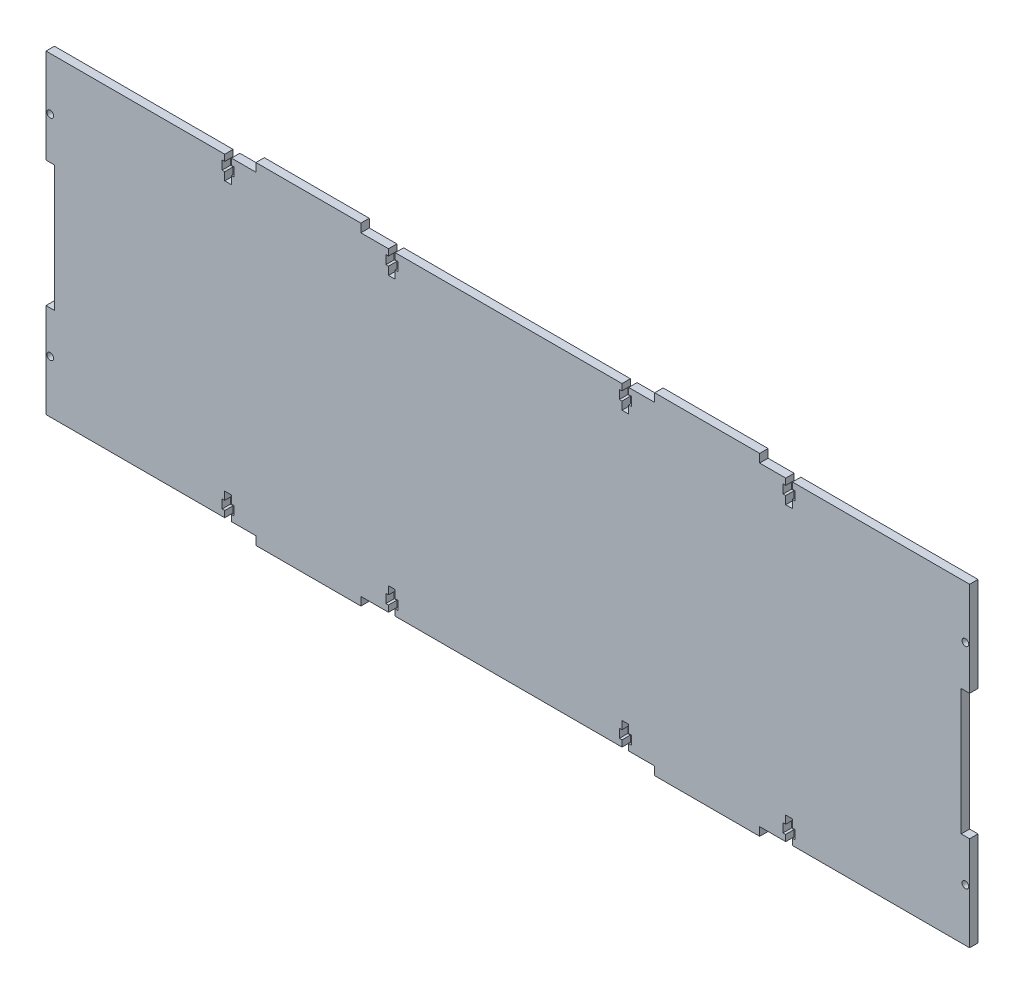
from build123d import *

# Parameters (mm, degrees)
ESQUISSE1_W             = 440
ESQUISSE1_H             = 150
BOSS_EXTRU_1_DEPTH      = 4
ESQUISSE2_W             = 4
ESQUISSE2_H             = 60
ENL_V_MAT_EXTRU_1_DEPTH = 4
ESQUISSE3_W             = 50
ESQUISSE3_H             = 4
BOSS_EXTRU_2_DEPTH      = 4
ENL_V_MAT_EXTRU_2_DEPTH = 10
ESQUISSE5_R             = 1.6
ENL_V_MAT_EXTRU_3_DEPTH = 4


with BuildPart() as part:
    # Esquisse1 → Boss.-Extru.1 (new body)
    with BuildSketch(Plane.XY):
        Rectangle(ESQUISSE1_W, ESQUISSE1_H)
    extrude(amount=BOSS_EXTRU_1_DEPTH)

    # Esquisse2 → Enlèv. mat.-Extru.1 (cut)
    with BuildSketch(Plane.XY.offset(4)):
        with Locations((-218, 0)):
            Rectangle(ESQUISSE2_W, ESQUISSE2_H)
        with Locations((218, 0)):
            Rectangle(ESQUISSE2_W, ESQUISSE2_H)
    extrude(amount=-ENL_V_MAT_EXTRU_1_DEPTH, mode=Mode.SUBTRACT)

    # Esquisse3 → Boss.-Extru.2 (add)
    with BuildSketch(Plane.XY.offset(4)):
        with Locations((-95, -77)):
            Rectangle(ESQUISSE3_W, ESQUISSE3_H)
        with Locations((95, -77)):
            Rectangle(ESQUISSE3_W, ESQUISSE3_H)
        with Locations((95, 77)):
            Rectangle(ESQUISSE3_W, ESQUISSE3_H)
        with Locations((-95, 77)):
            Rectangle(ESQUISSE3_W, ESQUISSE3_H)
    extrude(amount=-BOSS_EXTRU_2_DEPTH)

    # Esquisse4 → Enlèv. mat.-Extru.2 (cut)
    with BuildSketch(Plane.XY.offset(4)):
        Polygon((132.4, 75), (135.6, 75), (135.6, 72), (136.85, 72), (136.85, 67.8), (135.6, 67.8), (135.6, 64), (132.4, 64), (132.4, 67.8), (131.15, 67.8), (131.15, 72), (132.4, 72), align=None)
        Polygon((54.4, 75), (57.6, 75), (57.6, 72), (58.85, 72), (58.85, 67.8), (57.6, 67.8), (57.6, 64), (54.4, 64), (54.4, 67.8), (53.15, 67.8), (53.15, 72), (54.4, 72), align=None)
        Polygon((-56.849728223, 75), (-53.649728223, 75), (-53.649728223, 72), (-52.399728223, 72), (-52.399728223, 67.8), (-53.649728223, 67.8), (-53.649728223, 64), (-56.849728223, 64), (-56.849728223, 67.8), (-58.099728223, 67.8), (-58.099728223, 72), (-56.849728223, 72), align=None)
        Polygon((-134.849728223, 75), (-131.649728223, 75), (-131.649728223, 72), (-130.399728223, 72), (-130.399728223, 67.8), (-131.649728223, 67.8), (-131.649728223, 64), (-134.849728223, 64), (-134.849728223, 67.8), (-136.099728223, 67.8), (-136.099728223, 72), (-134.849728223, 72), align=None)
        Polygon((-131.649728223, -75), (-131.649728223, -72), (-130.399728223, -72), (-130.399728223, -67.8), (-131.649728223, -67.8), (-131.649728223, -64), (-134.849728223, -64), (-134.849728223, -67.8), (-136.099728223, -67.8), (-136.099728223, -72), (-134.849728223, -72), (-134.849728223, -75), align=None)
        Polygon((-53.649728223, -75), (-53.649728223, -72), (-52.399728223, -72), (-52.399728223, -67.8), (-53.649728223, -67.8), (-53.649728223, -64), (-56.849728223, -64), (-56.849728223, -67.8), (-58.099728223, -67.8), (-58.099728223, -72), (-56.849728223, -72), (-56.849728223, -75), align=None)
        Polygon((57.6, -75), (57.6, -72), (58.85, -72), (58.85, -67.8), (57.6, -67.8), (57.6, -64), (54.4, -64), (54.4, -67.8), (53.15, -67.8), (53.15, -72), (54.4, -72), (54.4, -75), align=None)
        Polygon((135.6, -75), (135.6, -72), (136.85, -72), (136.85, -67.8), (135.6, -67.8), (135.6, -64), (132.4, -64), (132.4, -67.8), (131.15, -67.8), (131.15, -72), (132.4, -72), (132.4, -75), align=None)
    extrude(amount=-ENL_V_MAT_EXTRU_2_DEPTH, mode=Mode.SUBTRACT)

    # Esquisse5 → Enlèv. mat.-Extru.3 (cut)
    with BuildSketch(Plane.XY.offset(4)):
        with Locations((218, -50)):
            Circle(ESQUISSE5_R)
        with Locations((218, 50)):
            Circle(ESQUISSE5_R)
        with Locations(Location((-218, 50, 0), (0, 0, 180))):
            Circle(ESQUISSE5_R)
        with Locations(Location((-218, -50, 0), (0, 0, 180))):
            Circle(ESQUISSE5_R)
    extrude(amount=-ENL_V_MAT_EXTRU_3_DEPTH, mode=Mode.SUBTRACT)


solid = part.part
